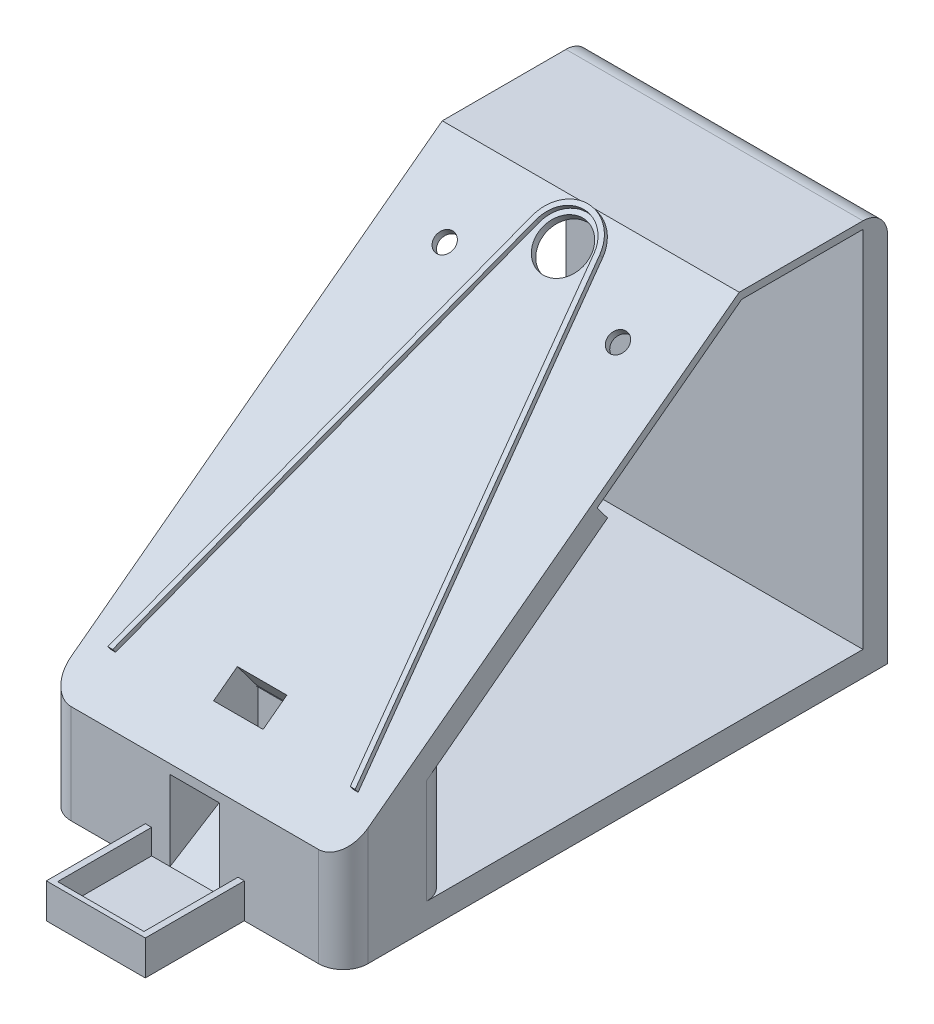
from build123d import *

# Parameters (mm, degrees)
SKETCH2_W                = 120
SKETCH2_H                = 110
BOSS_EXTRUDE1_DEPTH      = 80
CUT_EXTRUDE1_DEPTH       = 161.930246459
SKETCH6_R                = 2
SKETCH6_W                = 10
SKETCH6_H                = 5
CUT_EXTRUDE4_DEPTH       = 14
CUT_EXTRUDE6_DEPTH       = 161.930246459
CUT_EXTRUDE8_DEPTH       = 120
BOSS_EXTRUDE11_DEPTH     = 55
BOSS_EXTRUDE12_DEPTH     = 55
SKETCH17_W               = 10
SKETCH17_H               = 5
BOSS_EXTRUDE13_DEPTH     = 7.333333
CUT_EXTRUDE9_DEPTH       = 161.930246459
BOSS_EXTRUDE14_DEPTH     = 20
SKETCH20_W               = 17.446322517
SKETCH20_H               = 1
BOSS_EXTRUDE15_DEPTH     = 5
BOSS_EXTRUDE16_DEPTH     = 1
CUT_EXTRUDE10_DEPTH      = 30
CUT_EXTRUDE12_DEPTH      = 30
FILLET1_R                = 5
FILLET2_R                = 5
FILLET3_R                = 5
CUT_EXTRUDE13_REACH      = 123.365
SKETCH25_R               = 5
CUT_EXTRUDE14_START      = -6.666667
SKETCH26_W               = 10
SKETCH26_H               = 6
CUT_EXTRUDE14_DEPTH      = 6.666667
SKETCH30_W               = 10
SKETCH30_H               = 14
CUT_EXTRUDE16_DEPTH      = 4
CUT_EXTRUDE18_DEPTH      = 2
CUT_EXTRUDE18_DEPTH_BACK = 1
SKETCH31_W               = 10
SKETCH31_H               = 14.8
SKETCH32_W               = 10
SKETCH32_H               = 7.905630189
BOSS_EXTRUDE18_DEPTH     = 5
CUT_EXTRUDE19_DEPTH      = 114.367474283
CUT_EXTRUDE19_DEPTH_BACK = 114.367474283


with BuildPart() as part:
    # Sketch2 → Boss-Extrude1 (new body)
    with BuildSketch(Plane(origin=(0, 0, 0), x_dir=(1, 0, 0), z_dir=(0, 1, 0))):
        with Locations((27.236913342, 16.404091096)):
            Rectangle(SKETCH2_W, SKETCH2_H)
    extrude(amount=BOSS_EXTRUDE1_DEPTH)

    # Sketch3 → Cut-Extrude1 (cut, through all)
    with BuildSketch(Plane(origin=(87.236913342, 0, 0), x_dir=(0, 0, -1), z_dir=(1, 0, 0))):
        Polygon((-38.595908904, 80), (41.404091096, 80), (-38.595908904, 20), align=None)
    extrude(amount=-CUT_EXTRUDE1_DEPTH, mode=Mode.SUBTRACT)

    # Sketch6 → Cut-Extrude4 (cut)
    with BuildSketch(Plane(origin=(0, 31.326036274, 23.494527206), x_dir=(1, 0, 0), z_dir=(0, 0.8, 0.6))):
        with Locations(Location((9.736913342, 66.123272877, 0), (0, 0, 270))):
            Circle(SKETCH6_R)
        with BuildLine():
            ThreePointArc((31.736913342, 74.123272877), (30.418893857, 77.305253392), (27.236913342, 78.623272877))
            Line((27.236913342, 78.623272877), (27.236913342, 69.623272877))
            ThreePointArc((27.236913342, 69.623272877), (30.418893857, 70.941292361), (31.736913342, 74.123272877))
        make_face()
        with BuildLine():
            Line((27.236913342, 69.623272877), (27.236913342, 78.623272877))
            ThreePointArc((27.236913342, 78.623272877), (22.736913342, 74.123272877), (27.236913342, 69.623272877))
        make_face()
        with Locations(Location((44.736913342, 66.123272877, 0), (0, 0, 270))):
            Circle(SKETCH6_R)
        with Locations((27.236913342, -5.376727123)):
            Rectangle(SKETCH6_W, SKETCH6_H)
    extrude(amount=-CUT_EXTRUDE4_DEPTH, mode=Mode.SUBTRACT)

    # Sketch8 → Cut-Extrude6 (cut, through all)
    with BuildSketch(Plane(origin=(87.236913342, 0, 0), x_dir=(0, 0, -1), z_dir=(1, 0, 0))):
        Polygon((41.904091096, 78.5), (12.704091096, 56.6), (51.404091096, 5), (66.404091096, 5), (66.404091096, 78.5), align=None)
    extrude(amount=-CUT_EXTRUDE6_DEPTH, mode=Mode.SUBTRACT)

    # Sketch12 → Cut-Extrude8 (cut)
    with BuildSketch(Plane(origin=(87.236913342, 0, 0), x_dir=(0, 0, -1), z_dir=(1, 0, 0))):
        Polygon((-25.795908904, 10), (-25.795908904, 27.725), (-38.595908904, 18.125), (-38.595908904, 2), align=None)
    extrude(amount=-CUT_EXTRUDE8_DEPTH, mode=Mode.SUBTRACT)

    # Sketch13 → Boss-Extrude11 (add)
    with BuildSketch(Plane(origin=(87.236913342, 0, 0), x_dir=(0, 0, -1), z_dir=(1, 0, 0))):
        Polygon((-38.595908904, 18.125), (-25.795908904, 27.725), (-25.795908904, 10), (-38.595908904, 2), align=None)
    extrude(amount=-BOSS_EXTRUDE11_DEPTH)

    # Sketch14 → Boss-Extrude12 (add)
    with BuildSketch(Plane.ZY.offset(32.763086658)):
        Polygon((38.595908904, 18.125), (25.795908904, 27.725), (25.795908904, 10), (38.595908904, 2), align=None)
    extrude(amount=-BOSS_EXTRUDE12_DEPTH)

    # Sketch17 → Boss-Extrude13 (add)
    with BuildSketch(Plane(origin=(0, 20.126036274, 15.094527206), x_dir=(1, 0, 0), z_dir=(0, 0.8000000000000005, 0.5999999999999995))):
        with Locations((27.236913342, -5.376727123)):
            Rectangle(SKETCH17_W, SKETCH17_H)
    extrude(amount=BOSS_EXTRUDE13_DEPTH)

    # Sketch18 → Cut-Extrude9 (cut, through all)
    with BuildSketch(Plane(origin=(87.236913342, 0, 0), x_dir=(0, 0, -1), z_dir=(1, 0, 0))):
        Polygon((51.404091096, 5), (14.804111641, 53.799972607), (-16.825372102, 29.858521527), (-16.825372102, 5), align=None)
    extrude(amount=-CUT_EXTRUDE9_DEPTH, mode=Mode.SUBTRACT)

    # Sketch19 → Boss-Extrude14 (add)
    with BuildSketch(Plane.XY.offset(38.595908904)):
        Polygon((17.236913342, 0), (37.236913342, 0), (37.236913342, 7), (35.9600746, 7), (35.9600746, 2), (18.513752083, 2), (18.513752083, 7), (17.236913342, 7), align=None)
    extrude(amount=BOSS_EXTRUDE14_DEPTH)

    # Sketch20 → Boss-Extrude15 (add)
    with BuildSketch(Plane(origin=(0, 2, 0), x_dir=(1, 0, 0), z_dir=(0, 1, 0))):
        with Locations((27.236913342, -58.095908904)):
            Rectangle(SKETCH20_W, SKETCH20_H)
    extrude(amount=BOSS_EXTRUDE15_DEPTH)

    # Sketch21 → Boss-Extrude16 (add)
    with BuildSketch(Plane(origin=(0, 31.326036274, 23.494527206), x_dir=(1, 0, 0), z_dir=(0, 0.8, 0.6))):
        with BuildLine():
            Line((20.612624354, 71.860797373), (21.371214726, 75.385643561))
            ThreePointArc((21.371214726, 75.385643561), (27.236913342, 80.123272877), (33.102611958, 75.385643561))
            Line((33.102611958, 75.385643561), (33.86120233, 71.860797373))
            ThreePointArc((33.86120233, 71.860797373), (34.142346815, 72.976543378), (34.236913342, 74.123272877))
            ThreePointArc((34.236913342, 74.123272877), (34.197727754, 74.862909761), (34.080609707, 75.594265758))
            ThreePointArc((34.080609707, 75.594265758), (27.236913342, 81.123272877), (20.393216976, 75.594265758))
            ThreePointArc((20.393216976, 75.594265758), (20.248969874, 73.71260746), (20.612624354, 71.860797373))
        make_face()
        with BuildLine():
            ThreePointArc((34.236913342, 74.123272877), (34.142346815, 72.976543378), (33.86120233, 71.860797373))
            Line((33.86120233, 71.860797373), (51.236913342, -8.876727123))
            Line((51.236913342, -8.876727123), (52.236913342, -8.876727123))
            Line((52.236913342, -8.876727123), (34.080609707, 75.594265758))
            ThreePointArc((34.080609707, 75.594265758), (34.197727754, 74.862909761), (34.236913342, 74.123272877))
        make_face()
        with BuildLine():
            Line((3.236913342, -8.876727123), (20.612624354, 71.860797373))
            ThreePointArc((20.612624354, 71.860797373), (20.248969874, 73.71260746), (20.393216976, 75.594265758))
            Line((20.393216976, 75.594265758), (2.236913342, -8.876727123))
            Line((2.236913342, -8.876727123), (3.236913342, -8.876727123))
        make_face()
    extrude(amount=BOSS_EXTRUDE16_DEPTH)

    # Sketch23 → Cut-Extrude10 (cut)
    with BuildSketch(Plane(origin=(87.236913342, 0, 0), x_dir=(0, 0, -1), z_dir=(1, 0, 0))):
        Polygon((-38.595908904, 0), (-38.595908904, 20), (41.404091096, 80), (71.404091096, 80), (71.404091096, 0), align=None)
    extrude(amount=-CUT_EXTRUDE10_DEPTH, mode=Mode.SUBTRACT)

    # Sketch24 → Cut-Extrude12 (cut)
    with BuildSketch(Plane.ZY.offset(32.763086658)):
        Polygon((-71.404091096, 80), (-41.404091096, 80), (38.595908904, 20), (38.595908904, 0), (-71.404091096, 0), align=None)
    extrude(amount=-CUT_EXTRUDE12_DEPTH, mode=Mode.SUBTRACT)

    # Fillet1
    fillet1_edges = [part.edges().sort_by_distance(p)[0] for p in [
        (27.236913342, 80, -71.404091096),
    ]]
    fillet(fillet1_edges, radius=FILLET1_R)

    # Fillet2
    fillet2_edges = [part.edges().sort_by_distance(p)[0] for p in [
        (57.236913342, 10, 38.595908904),
        (-2.763086658, 10, 38.595908904),
    ]]
    fillet(fillet2_edges, radius=FILLET2_R)

    # Fillet3
    fillet3_edges = [part.edges().sort_by_distance(p)[0] for p in [
        (57.236913342, 17.429260763, 16.825372102),
        (-2.763086658, 17.429260763, 16.825372102),
    ]]
    fillet(fillet3_edges, radius=FILLET3_R)

    # Sketch25 → Cut-Extrude13 (cut, up to next)
    with BuildSketch(Plane(origin=(0, 31.326036274, 23.494527206), x_dir=(1, 0, 0), z_dir=(0, 0.8, 0.6)), mode=Mode.PRIVATE) as cut_extrude13_sk1:
        with Locations(Location((27.236913342, 74.123272877, 0), (0, 0, 270))):
            Circle(SKETCH25_R)
    cut_extrude13_tool1 = extrude(cut_extrude13_sk1.sketch, amount=-CUT_EXTRUDE13_REACH, mode=Mode.PRIVATE) & part.part
    add(cut_extrude13_tool1.solids().sort_by_distance((27.236913, 75.8, -35.804091))[0], mode=Mode.SUBTRACT)

    # Sketch26 → Cut-Extrude14 (cut)
    with BuildSketch(Plane(origin=(0, 31.326036274, 23.494527206), x_dir=(1, 0, 0), z_dir=(0, 0.8, 0.6)).offset(CUT_EXTRUDE14_START)):
        with Locations((27.236913342, -4.876727123)):
            Rectangle(SKETCH26_W, SKETCH26_H)
    extrude(amount=CUT_EXTRUDE14_DEPTH, mode=Mode.SUBTRACT)

    # Sketch30 → Cut-Extrude16 (cut)
    with BuildSketch(Plane.XY.offset(25.795908904)):
        with Locations((27.236913342, 17)):
            Rectangle(SKETCH30_W, SKETCH30_H)
    extrude(amount=-CUT_EXTRUDE16_DEPTH, mode=Mode.SUBTRACT)

    # Sketch31 → Cut-Extrude18 (cut, two sides: drawn at the far end of the back side and taken through both)
    with BuildSketch(Plane.XY.offset(21.795908904).offset(-CUT_EXTRUDE18_DEPTH_BACK)):
        with Locations((27.236913342, 17.4)):
            Rectangle(SKETCH31_W, SKETCH31_H)
    extrude(amount=CUT_EXTRUDE18_DEPTH + CUT_EXTRUDE18_DEPTH_BACK, mode=Mode.SUBTRACT)

    # Sketch32 → Boss-Extrude18 (add)
    with BuildSketch(Plane(origin=(0, 18.784678159, 11.740423849), x_dir=(1, 0, 0), z_dir=(0, 0.8479983040050879, 0.5299989400031804))):
        with Locations((27.236913342, -12.622082506)):
            Rectangle(SKETCH32_W, SKETCH32_H)
    extrude(amount=-BOSS_EXTRUDE18_DEPTH)

    # Sketch36 → Cut-Extrude19 (cut, two sides: drawn at the far end of the back side and taken through both)
    with BuildSketch(Plane(origin=(32.236913342, 0, 0), x_dir=(0, 0, -1), z_dir=(1, 0, 0)).offset(-CUT_EXTRUDE19_DEPTH_BACK)):
        Polygon((-16.441953212, 9.9499841), (-16.825372102, 10.563454323), (-16.825372102, 9.710347294), align=None)
    extrude(amount=CUT_EXTRUDE19_DEPTH + CUT_EXTRUDE19_DEPTH_BACK, mode=Mode.SUBTRACT)


solid = part.part
